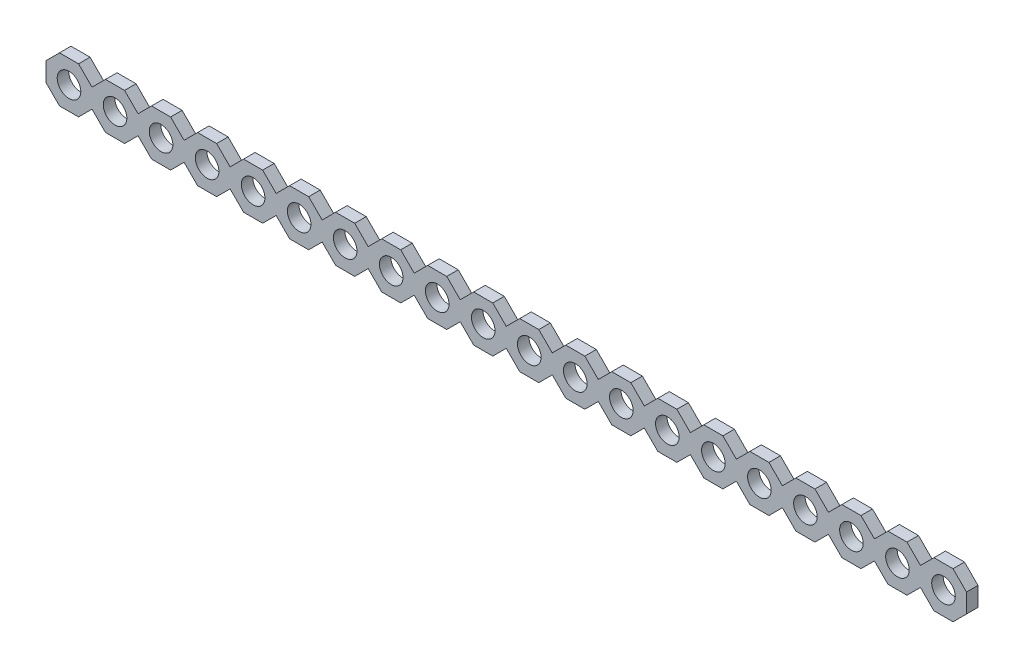
from build123d import *

# Parameters (mm, degrees)
SKETCH1_R           = 2.05
BOSS_EXTRUDE1_DEPTH = 2
LPATTERN1_COUNT     = 20
LPATTERN1_PITCH     = 8


with BuildPart() as part:
    # Sketch1 → Boss-Extrude1 (new body)
    with BuildSketch(Plane.XY):
        Polygon((1.656854249, 4), (-1.656854249, 4), (-4, 1.656854249), (-4, -1.656854249), (-1.656854249, -4), (1.656854249, -4), (4, -1.656854249), (4, 1.656854249), align=None)
        Circle(SKETCH1_R, mode=Mode.SUBTRACT)
    boss_extrude1 = extrude(amount=BOSS_EXTRUDE1_DEPTH)

    # LPattern1: Boss-Extrude1 ×20
    with Locations(*[(i * LPATTERN1_PITCH, 0, 0) for i in range(1, LPATTERN1_COUNT)]):
        add(boss_extrude1)


solid = part.part
